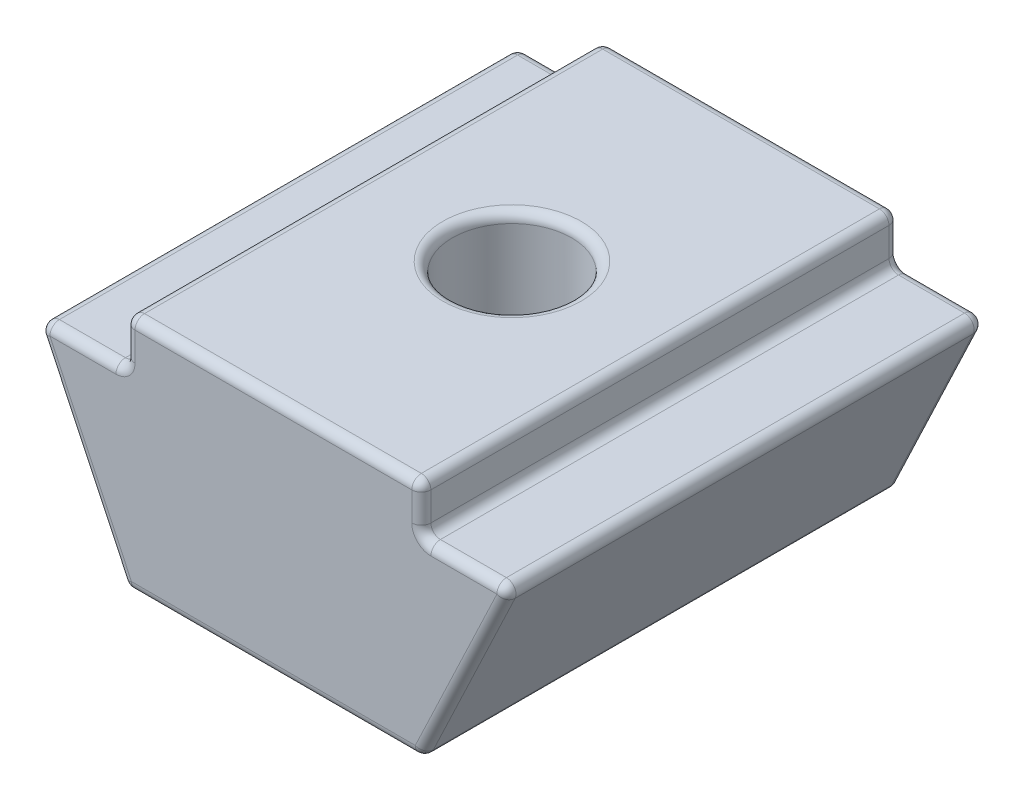
from build123d import *

# Parameters (mm, degrees)
NUTEXTRUSION_DEPTH    = 10
M3X0_5_TAPPED_HOLE1_D = 2.5
COSMETIC_FILLETS_R    = 0.2


with BuildPart() as part:
    # MainSketch → NutExtrusion (new body)
    with BuildSketch(Plane.XY):
        Polygon((-3.1, 0), (3.1, 0), (5, 4), (3.1, 4), (3.1, 5), (-3.1, 5), (-3.1, 4), (-5, 4), align=None)
    extrude(amount=NUTEXTRUSION_DEPTH)

    # M3x0.5 Tapped Hole1 (through all)
    with Locations(Plane(origin=(0, 5, 0), x_dir=(1, 0, 0), z_dir=(0, 1, 0))):
        with Locations((0, -5)):
            Hole(M3X0_5_TAPPED_HOLE1_D / 2)

    # Cosmetic Fillets
    cosmetic_fillets_edges = [part.edges().sort_by_distance(p)[0] for p in [
        (4.05, 4, 0),
        (3.1, 4, 5),
        (3.1, 4.5, 0),
        (3.1, 5, 5),
        (0, 5, 0),
        (-3.1, 5, 5),
        (1.25, 5, 5),
        (1.25, 0, 5),
        (-3.1, 4.5, 0),
        (-3.1, 4, 5),
        (-4.05, 4, 0),
        (-5, 4, 5),
        (-4.05, 2, 0),
        (-3.1, 0, 5),
        (0, 0, 0),
        (0, 0, 10),
        (4.05, 2, 10),
        (4.05, 4, 10),
        (3.1, 4.5, 10),
        (0, 5, 10),
        (-3.1, 4.5, 10),
        (-4.05, 4, 10),
        (-4.05, 2, 10),
        (3.1, 0, 5),
        (4.05, 2, 0),
        (5, 4, 5),
    ]]
    fillet(cosmetic_fillets_edges, radius=COSMETIC_FILLETS_R)


solid = part.part
